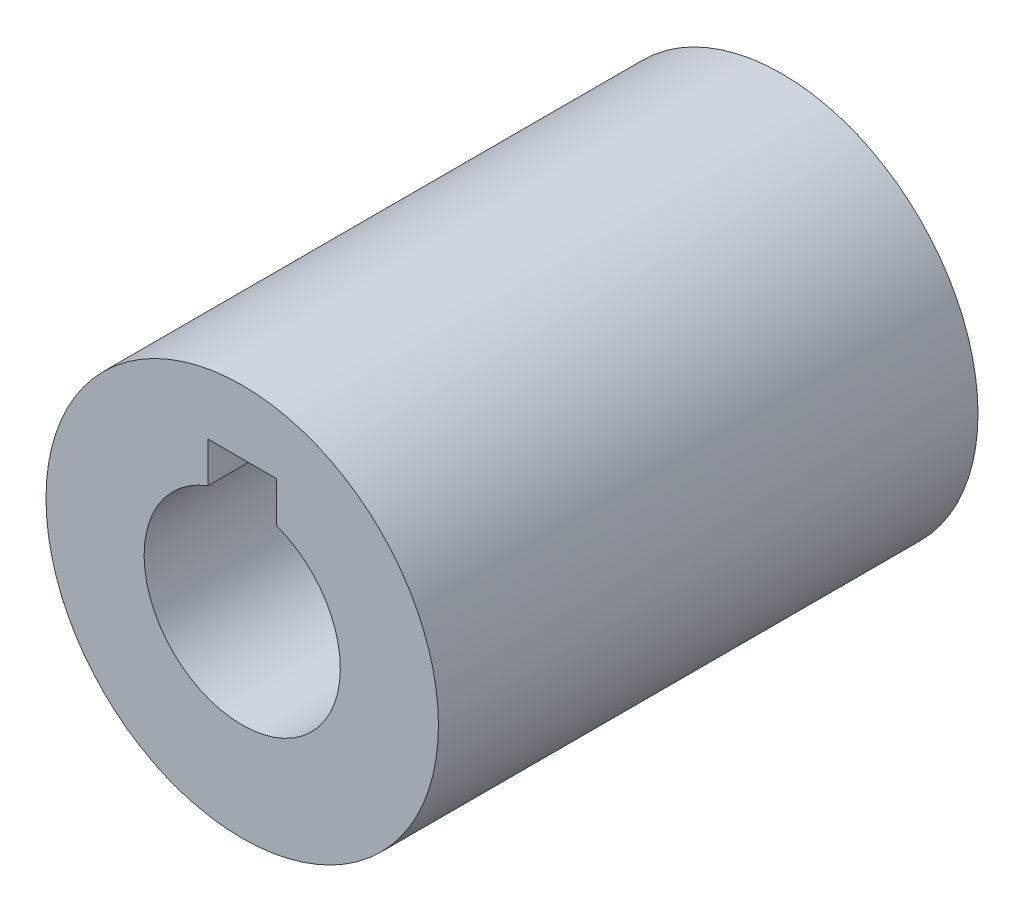
from build123d import *

# Parameters (mm, degrees)
SKETCH_1_R      = 20
EXTRUDE_1_DEPTH = 55


with BuildPart() as part:
    # Эскиз1 → Бобышка-Вытянуть1 (new body)
    with BuildSketch(Plane.XY):
        Circle(SKETCH_1_R)
        with BuildLine():
            ThreePointArc((10, 0), (-5.700877125, -8.215838363), (-3.5, 9.367496998))
            Line((-3.5, 9.367496998), (-3.5, 13.5))
            Line((-3.5, 13.5), (3.5, 13.5))
            Line((3.5, 13.5), (3.5, 9.367496998))
            ThreePointArc((3.5, 9.367496998), (8.215838363, 5.700877125), (10, 0))
        make_face(mode=Mode.SUBTRACT)
    extrude(amount=EXTRUDE_1_DEPTH)


solid = part.part
